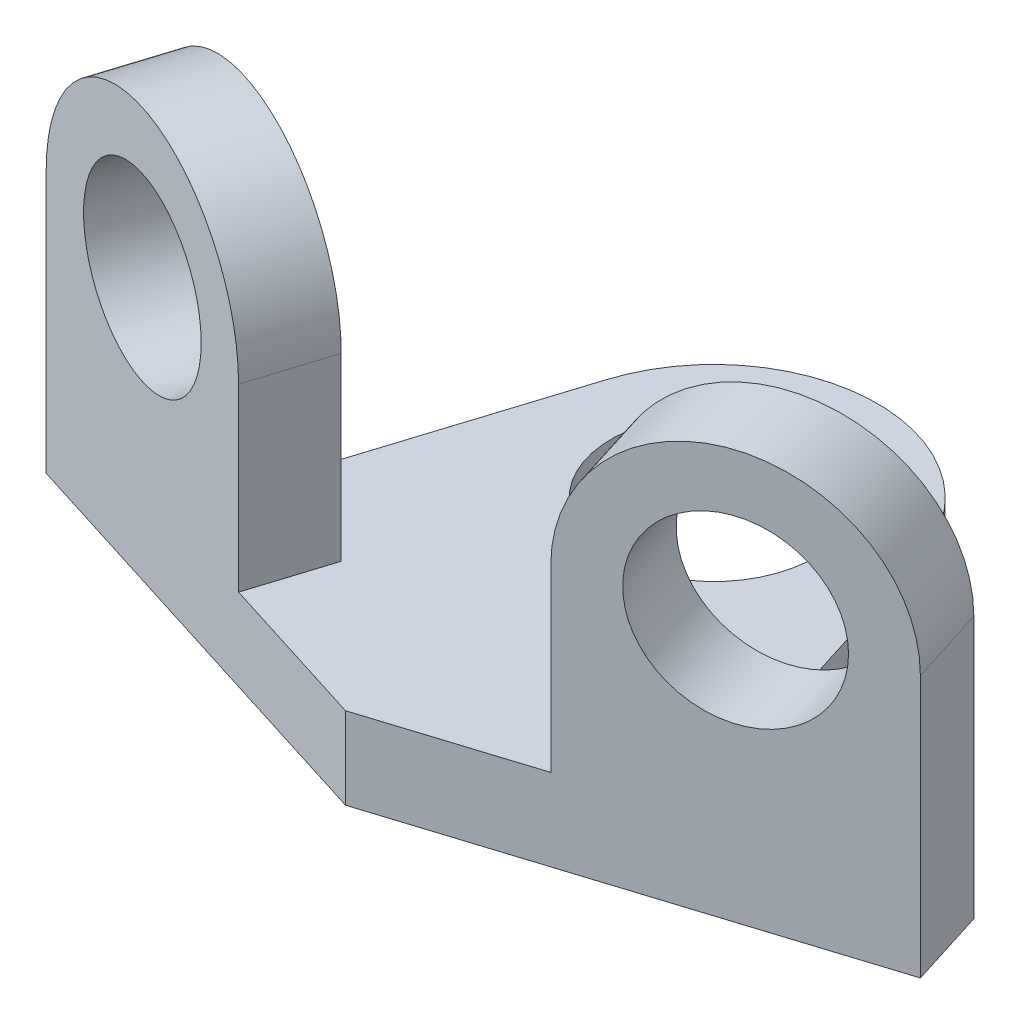
from build123d import *

# Parameters (mm, degrees)
SKETCH1_R           = 12.5
BOSS_EXTRUDE1_DEPTH = 10
BOSS_EXTRUDE2_DEPTH = 32
SKETCH2_R           = 18
SKETCH2_R_2         = 11
BOSS_EXTRUDE5_DEPTH = 10
SKETCH6_R           = 11
CUT_EXTRUDE1_DEPTH  = 10
SKETCH10_R          = 18
SKETCH10_R_2        = 11
BOSS_EXTRUDE8_DEPTH = 10
SKETCH11_R          = 11
CUT_EXTRUDE3_DEPTH  = 10


with BuildPart() as part:
    # Sketch1 → Boss-Extrude1 (new body)
    with BuildSketch(Plane(origin=(0, 0, 0), x_dir=(1, 0, 0), z_dir=(0, 1, 0))):
        with BuildLine():
            Line((-19.074339015, -38.98588401), (0, -45))
            Line((0, -45), (19.074339015, -38.98588401))
            Line((19.074339015, -38.98588401), (16.06728102, -29.448714502))
            Line((16.06728102, -29.448714502), (28.972750838, -25.379635499))
            Line((28.972750838, -25.379635499), (19.074339015, 6.01411599))
            ThreePointArc((19.074339015, 6.01411599), (0, 20), (-19.074339015, 6.01411599))
            Line((-19.074339015, 6.01411599), (-28.972750838, -25.379635499))
            Line((-28.972750838, -25.379635499), (-16.06728102, -29.448714502))
            Line((-16.06728102, -29.448714502), (-19.074339015, -38.98588401))
        make_face()
        Circle(SKETCH1_R, mode=Mode.SUBTRACT)
    extrude(amount=BOSS_EXTRUDE1_DEPTH)

    # Sketch1<3> → Boss-Extrude2 (add)
    with BuildSketch(Plane(origin=(0, 0, 0), x_dir=(1, 0, 0), z_dir=(0, 1, 0))):
        Polygon((-16.06728102, -29.448714502), (-50.401091247, -18.62330572), (-53.408149242, -28.160475228), (-19.074339015, -38.98588401), align=None)
        Polygon((50.401091247, -18.62330572), (16.06728102, -29.448714502), (19.074339015, -38.98588401), (53.408149242, -28.160475228), align=None)
    extrude(amount=BOSS_EXTRUDE2_DEPTH)

    # Sketch2 → Boss-Extrude5 (add)
    with BuildSketch(Plane(origin=(12.905469818, 0, 40.930920997), x_dir=(0.9537169507482267, 0, -0.30070579950427384), z_dir=(0.30070579950427384, 0, 0.9537169507482267))):
        with Locations((24.468239022, 32)):
            Circle(SKETCH2_R)
        with Locations((24.468239022, 32)):
            Circle(SKETCH2_R_2, mode=Mode.SUBTRACT)
    extrude(amount=-BOSS_EXTRUDE5_DEPTH)

    # Sketch6 → Cut-Extrude1 (cut)
    with BuildSketch(Plane(origin=(12.905469818, 0, 40.930920997), x_dir=(0.9537169507482267, 0, -0.30070579950427384), z_dir=(0.30070579950427384, 0, 0.9537169507482267))):
        with Locations((24.468239022, 32)):
            Circle(SKETCH6_R)
    extrude(amount=-CUT_EXTRUDE1_DEPTH, mode=Mode.SUBTRACT)

    # Sketch10 → Boss-Extrude8 (add)
    with BuildSketch(Plane(origin=(-12.905469818, 0, 40.930920997), x_dir=(0.9537169507482269, 0, 0.3007057995042734), z_dir=(-0.3007057995042734, 0, 0.9537169507482269))):
        with Locations((-24.468239022, 32)):
            Circle(SKETCH10_R)
        with Locations((-24.468239022, 32)):
            Circle(SKETCH10_R_2, mode=Mode.SUBTRACT)
    extrude(amount=-BOSS_EXTRUDE8_DEPTH)

    # Sketch11 → Cut-Extrude3 (cut)
    with BuildSketch(Plane(origin=(-12.905469818, 0, 40.930920997), x_dir=(0.9537169507482269, 0, 0.3007057995042734), z_dir=(-0.3007057995042734, 0, 0.9537169507482269))):
        with Locations((-24.468239022, 32)):
            Circle(SKETCH11_R)
    extrude(amount=-CUT_EXTRUDE3_DEPTH, mode=Mode.SUBTRACT)


solid = part.part
